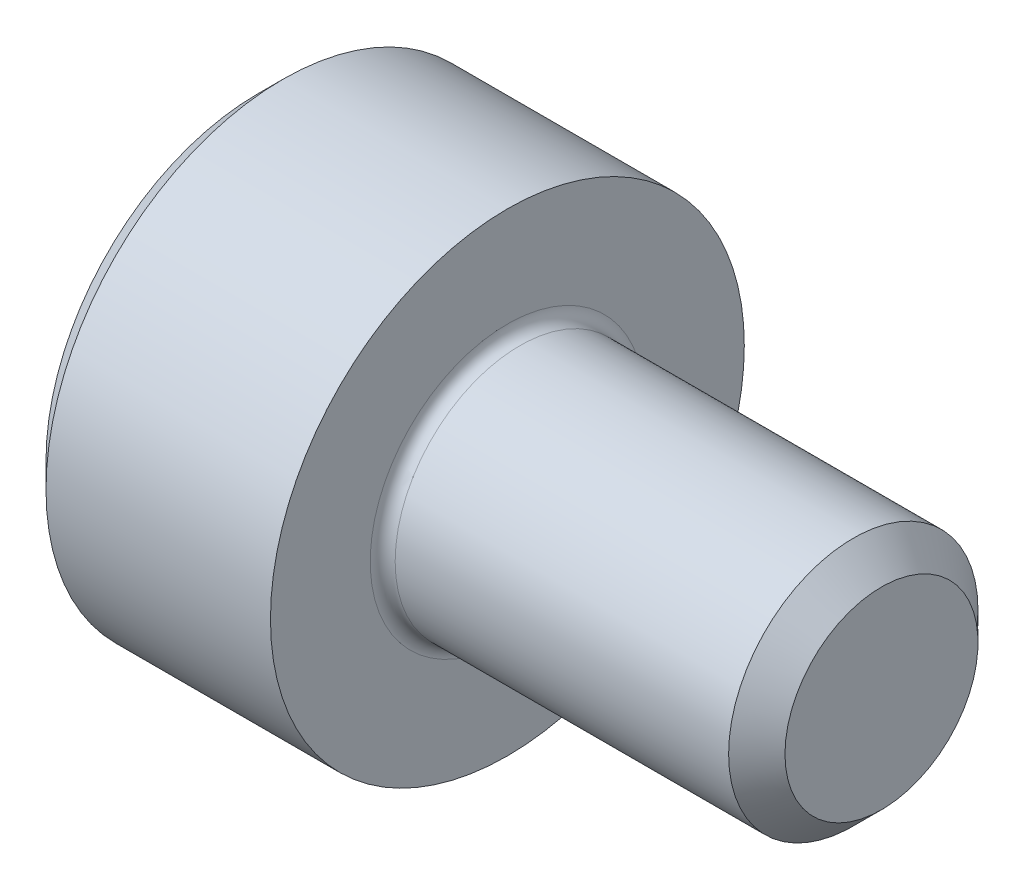
from build123d import *

# Parameters (mm, degrees)
FILLET1_R   = 0.1
HEX_2_DEPTH = 1


with BuildPart() as part:
    # BodySke → Base-Revolve (revolve)
    with BuildSketch(Plane.XY, mode=Mode.PRIVATE) as base_revolve_sk:
        Polygon((0, 0), (0, 1.7), (0.2, 1.9), (2, 1.9), (2, 1), (4.774, 1), (5, 0.774), (5, 0), align=None)
    revolve(base_revolve_sk.sketch.rotate(Axis((-31.75, 0, 0), (1, 0, 0)), 90), axis=Axis((-31.75, 0, 0), (1, 0, 0)))

    # Fillet1
    fillet1_edges = [part.edges().sort_by_distance(p)[0] for p in [
        (2, 0, -1),
    ]]
    fillet(fillet1_edges, radius=FILLET1_R)

    # Sketch2 → Hex-PreBroach (revolve, cut)
    with BuildSketch(Plane.XY, mode=Mode.PRIVATE) as hex_prebroach_sk:
        Polygon((0, 0.7725), (1, 0.7725), (1.446003083, 0), (0, 0), align=None)
    revolve(hex_prebroach_sk.sketch.rotate(Axis((0, 0, 0), (1, 0, 0)), 90), axis=Axis((0, 0, 0), (1, 0, 0)), mode=Mode.SUBTRACT)

    # Sketch3 → Hex 2 (cut)
    with BuildSketch(Plane(origin=(0, 0, 0), x_dir=(0, 0.500000000000001, 0.866025403784438), z_dir=(-1, 0, 0))):
        Polygon((0.446003083, 0.7725), (-0.446003083, 0.7725), (-0.892006166, 0), (-0.446003083, -0.7725), (0.446003083, -0.7725), (0.892006166, 0), align=None)
    extrude(amount=-HEX_2_DEPTH, mode=Mode.SUBTRACT)


solid = part.part
